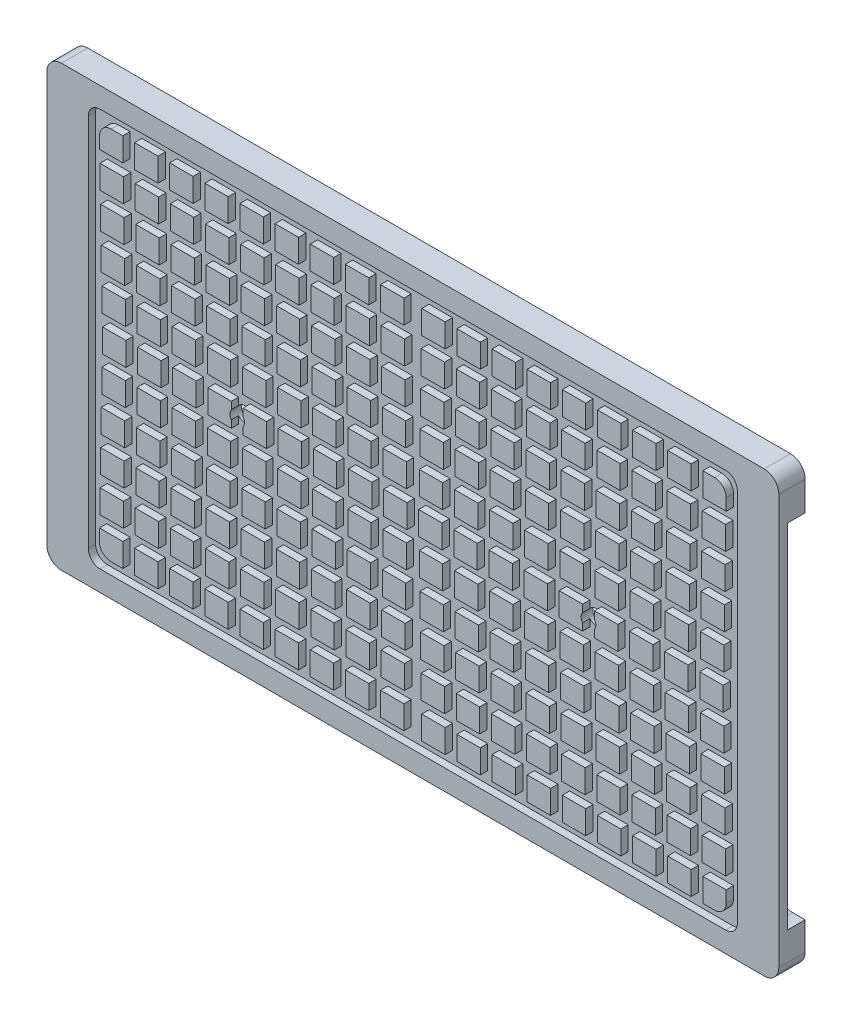
from build123d import *
from build123d.topology import SkipClean

# Parameters (mm, degrees)
EXTRUDE_1_DEPTH     = 9
EXTRUDE_2_DEPTH     = 0.6
CUT_EXTRUDE_1_DEPTH = 6
SKETCH_5_R          = 2.25
CUT_EXTRUDE_2_DEPTH = 15
SKETCH_7_R          = 2.5
CUT_EXTRUDE_3_DEPTH = 15
SKETCH_8_R          = 2.5
CUT_EXTRUDE_4_DEPTH = 5
CUT_EXTRUDE_START   = -2.5
SKETCH_9_W          = 8
SKETCH_9_H          = 8
CUT_EXTRUDE_5_DEPTH = 2.5
SKETCH_10_R         = 1.25
CUT_EXTRUDE_6_DEPTH = 6.5
CUT_EXTRUDE_7_DEPTH = 1


with BuildPart() as part:
    # 草图2 → 凸台-拉伸1 (new body)
    with BuildSketch(Plane.XY):
        with BuildLine():
            Line((-120, 75), (120, 75))
            ThreePointArc((120, 75), (123.535533906, 73.535533906), (125, 70))
            Line((125, 70), (125, -70))
            ThreePointArc((125, -70), (123.535533906, -73.535533906), (120, -75))
            Line((120, -75), (-120, -75))
            ThreePointArc((-120, -75), (-123.535533906, -73.535533906), (-125, -70))
            Line((-125, -70), (-125, 70))
            ThreePointArc((-125, 70), (-123.535533906, 73.535533906), (-120, 75))
        make_face()
    extrude(amount=EXTRUDE_1_DEPTH)

    # 草图3 → 凸台-拉伸2 (add)
    with BuildSketch(Plane(origin=(0, 0, 0), x_dir=(-1, 0, 0), z_dir=(0, 0, -1))):
        with BuildLine():
            Line((-99.253334042, 67), (99.253334042, 67))
            ThreePointArc((99.253334042, 67), (104.731054073, 64.731054073), (107, 59.253334042))
            Line((107, 59.253334042), (107, -59.253334042))
            ThreePointArc((107, -59.253334042), (104.731054073, -64.731054073), (99.253334042, -67))
            Line((99.253334042, -67), (-99.253334042, -67))
            ThreePointArc((-99.253334042, -67), (-104.731054073, -64.731054073), (-107, -59.253334042))
            Line((-107, -59.253334042), (-107, 59.253334042))
            ThreePointArc((-107, 59.253334042), (-104.731054073, 64.731054073), (-99.253334042, 67))
        make_face()
        with BuildLine():
            Line((-99.253334042, 65), (99.253334042, 65))
            ThreePointArc((99.253334042, 65), (103.31684051, 63.31684051), (105, 59.253334042))
            Line((105, 59.253334042), (105, -59.253334042))
            ThreePointArc((105, -59.253334042), (103.31684051, -63.31684051), (99.253334042, -65))
            Line((99.253334042, -65), (-99.253334042, -65))
            ThreePointArc((-99.253334042, -65), (-103.31684051, -63.31684051), (-105, -59.253334042))
            Line((-105, -59.253334042), (-105, 59.253334042))
            ThreePointArc((-105, 59.253334042), (-103.31684051, 63.31684051), (-99.253334042, 65))
        make_face(mode=Mode.SUBTRACT)
    extrude(amount=EXTRUDE_2_DEPTH)

    # 草图4 → 切除-拉伸1 (cut)
    with BuildSketch(Plane(origin=(0, 0, 0), x_dir=(-1, 0, 0), z_dir=(0, 0, -1))):
        with BuildLine():
            Line((125, -60.380854599), (120.746665958, -60.380854599))
            ThreePointArc((120.746665958, -60.380854599), (116.68315949, -58.697695109), (115, -54.634188641))
            Line((115, -54.634188641), (115, 54.253334042))
            ThreePointArc((115, 54.253334042), (116.68315949, 58.31684051), (120.746665958, 60))
            Line((120.746665958, 60), (125, 60))
            Line((125, 60), (125, -60.380854599))
        make_face()
        with BuildLine():
            Line((-115, -54.634188641), (-115, 54.253334042))
            ThreePointArc((-115, 54.253334042), (-116.68315949, 58.31684051), (-120.746665958, 60))
            Line((-120.746665958, 60), (-125, 60))
            Line((-125, 60), (-125, -60.380854599))
            Line((-125, -60.380854599), (-120.746665958, -60.380854599))
            ThreePointArc((-120.746665958, -60.380854599), (-116.68315949, -58.697695109), (-115, -54.634188641))
        make_face()
    extrude(amount=-CUT_EXTRUDE_1_DEPTH, mode=Mode.SUBTRACT)

    # 草图5 → 切除-拉伸2 (cut)
    with BuildSketch(Plane.XZ.offset(75)):
        with Locations((-15, 3.5)):
            Circle(SKETCH_5_R)
        with Locations((15, 3.5)):
            Circle(SKETCH_5_R)
    extrude(amount=-CUT_EXTRUDE_2_DEPTH, mode=Mode.SUBTRACT)

    # 草图7 → 切除-拉伸3 (cut)
    with BuildSketch(Plane(origin=(0, 0, 0), x_dir=(-1, 0, 0), z_dir=(0, 0, -1))):
        with Locations((60, 0)):
            Circle(SKETCH_7_R)
        with Locations((-60, 0)):
            Circle(SKETCH_7_R)
    extrude(amount=-CUT_EXTRUDE_3_DEPTH, mode=Mode.SUBTRACT)

    # 草图8 → 切除-拉伸4 (cut)
    # profile 1 of 2: a face of its own
    with BuildSketch(Plane(origin=(0, 0, 0), x_dir=(-1, 0, 0), z_dir=(0, 0, -1))):
        with BuildLine():
            Line((95.911033681, 60), (7.088966319, 60))
            ThreePointArc((7.088966319, 60), (4.197630507, 58.802369493), (3, 55.911033681))
            Line((3, 55.911033681), (3, -55.911033681))
            ThreePointArc((3, -55.911033681), (4.197630507, -58.802369493), (7.088966319, -60))
            Line((7.088966319, -60), (95, -60))
            ThreePointArc((95, -60), (98.535533906, -58.535533906), (100, -55))
            Line((100, -55), (100, 55.911033681))
            ThreePointArc((100, 55.911033681), (98.802369493, 58.802369493), (95.911033681, 60))
        make_face()
        with Locations((60, 0)):
            Circle(SKETCH_8_R, mode=Mode.SUBTRACT)
    # profile 2 of 2: a face of its own
    with BuildSketch(Plane(origin=(0, 0, 0), x_dir=(-1, 0, 0), z_dir=(0, 0, -1))):
        with BuildLine():
            Line((-7.088966319, 60), (-95, 60))
            ThreePointArc((-95, 60), (-98.535533906, 58.535533906), (-100, 55))
            Line((-100, 55), (-100, -55))
            ThreePointArc((-100, -55), (-98.535533906, -58.535533906), (-95, -60))
            Line((-95, -60), (-7.088966319, -60))
            ThreePointArc((-7.088966319, -60), (-4.197630507, -58.802369493), (-3, -55.911033681))
            Line((-3, -55.911033681), (-3, 55.911033681))
            ThreePointArc((-3, 55.911033681), (-4.197630507, 58.802369493), (-7.088966319, 60))
        make_face()
        with Locations((-60, 0)):
            Circle(SKETCH_8_R, mode=Mode.SUBTRACT)
    extrude(amount=-CUT_EXTRUDE_4_DEPTH, mode=Mode.SUBTRACT)

    # 草图9 → 切除-拉伸5 (cut)
    with SkipClean():  # the faces are left unmerged after this step: merging them gives an invalid solid
        with BuildSketch(Plane.XY.offset(9).offset(CUT_EXTRUDE_START)):
            with BuildLine():
                Line((106.837715509, 67.990861709), (-106.837715509, 67.990861709))
                ThreePointArc((-106.837715509, 67.990861709), (-109.666142634, 66.819288834), (-110.837715509, 63.990861709))
                Line((-110.837715509, 63.990861709), (-110.837715509, -63.990861709))
                ThreePointArc((-110.837715509, -63.990861709), (-109.666142634, -66.819288834), (-106.837715509, -67.990861709))
                Line((-106.837715509, -67.990861709), (106.837715509, -67.990861709))
                ThreePointArc((106.837715509, -67.990861709), (109.666142634, -66.819288834), (110.837715509, -63.990861709))
                Line((110.837715509, -63.990861709), (110.837715509, 63.990861709))
                ThreePointArc((110.837715509, 63.990861709), (109.666142634, 66.819288834), (106.837715509, 67.990861709))
            make_face()
            with BuildLine():
                Line((-107.047144386, -59.990861709), (-107.047144386, -55.990861709))
                Line((-107.047144386, -55.990861709), (-99.047144386, -55.990861709))
                Line((-99.047144386, -55.990861709), (-99.047144386, -63.990861709))
                Line((-99.047144386, -63.990861709), (-103.047144386, -63.990861709))
                ThreePointArc((-103.047144386, -63.990861709), (-105.875571511, -62.819288834), (-107.047144386, -59.990861709))
            make_face(mode=Mode.SUBTRACT)
            with Locations((-91.047144386, -59.990861709)):
                Rectangle(SKETCH_9_W, SKETCH_9_H, mode=Mode.SUBTRACT)
            with Locations((-79.047144386, -59.990861709)):
                Rectangle(SKETCH_9_W, SKETCH_9_H, mode=Mode.SUBTRACT)
            with Locations((-67.047144386, -59.990861709)):
                Rectangle(SKETCH_9_W, SKETCH_9_H, mode=Mode.SUBTRACT)
            with Locations((-102.837715509, -47.992689368)):
                Rectangle(SKETCH_9_W, SKETCH_9_H, mode=Mode.SUBTRACT)
            with Locations((-90.837715509, -47.992689368)):
                Rectangle(SKETCH_9_W, SKETCH_9_H, mode=Mode.SUBTRACT)
            with Locations((-102.628286632, -35.994517026)):
                Rectangle(SKETCH_9_W, SKETCH_9_H, mode=Mode.SUBTRACT)
            with Locations((-90.628286632, -35.994517026)):
                Rectangle(SKETCH_9_W, SKETCH_9_H, mode=Mode.SUBTRACT)
            with Locations((-78.837715509, -47.992689368)):
                Rectangle(SKETCH_9_W, SKETCH_9_H, mode=Mode.SUBTRACT)
            with Locations((-66.837715509, -47.992689368)):
                Rectangle(SKETCH_9_W, SKETCH_9_H, mode=Mode.SUBTRACT)
            with Locations((-78.628286632, -35.994517026)):
                Rectangle(SKETCH_9_W, SKETCH_9_H, mode=Mode.SUBTRACT)
            with Locations((-66.628286632, -35.994517026)):
                Rectangle(SKETCH_9_W, SKETCH_9_H, mode=Mode.SUBTRACT)
            with Locations((-55.047144386, -59.990861709)):
                Rectangle(SKETCH_9_W, SKETCH_9_H, mode=Mode.SUBTRACT)
            with Locations((-43.047144386, -59.990861709)):
                Rectangle(SKETCH_9_W, SKETCH_9_H, mode=Mode.SUBTRACT)
            with Locations((-31.047144386, -59.990861709)):
                Rectangle(SKETCH_9_W, SKETCH_9_H, mode=Mode.SUBTRACT)
            with Locations((-19.047144386, -59.990861709)):
                Rectangle(SKETCH_9_W, SKETCH_9_H, mode=Mode.SUBTRACT)
            with Locations((-7.047144386, -59.990861709)):
                Rectangle(SKETCH_9_W, SKETCH_9_H, mode=Mode.SUBTRACT)
            with Locations((-54.837715509, -47.992689368)):
                Rectangle(SKETCH_9_W, SKETCH_9_H, mode=Mode.SUBTRACT)
            with Locations((-42.837715509, -47.992689368)):
                Rectangle(SKETCH_9_W, SKETCH_9_H, mode=Mode.SUBTRACT)
            with Locations((-30.837715509, -47.992689368)):
                Rectangle(SKETCH_9_W, SKETCH_9_H, mode=Mode.SUBTRACT)
            with Locations((-54.628286632, -35.994517026)):
                Rectangle(SKETCH_9_W, SKETCH_9_H, mode=Mode.SUBTRACT)
            with Locations((-42.628286632, -35.994517026)):
                Rectangle(SKETCH_9_W, SKETCH_9_H, mode=Mode.SUBTRACT)
            with Locations((-30.628286632, -35.994517026)):
                Rectangle(SKETCH_9_W, SKETCH_9_H, mode=Mode.SUBTRACT)
            with Locations((-18.837715509, -47.992689368)):
                Rectangle(SKETCH_9_W, SKETCH_9_H, mode=Mode.SUBTRACT)
            with Locations((-6.837715509, -47.992689368)):
                Rectangle(SKETCH_9_W, SKETCH_9_H, mode=Mode.SUBTRACT)
            with Locations((-18.628286632, -35.994517026)):
                Rectangle(SKETCH_9_W, SKETCH_9_H, mode=Mode.SUBTRACT)
            with Locations((-6.628286632, -35.994517026)):
                Rectangle(SKETCH_9_W, SKETCH_9_H, mode=Mode.SUBTRACT)
            with Locations((-102.418857754, -23.996344684)):
                Rectangle(SKETCH_9_W, SKETCH_9_H, mode=Mode.SUBTRACT)
            with Locations((-90.418857754, -23.996344684)):
                Rectangle(SKETCH_9_W, SKETCH_9_H, mode=Mode.SUBTRACT)
            with Locations((-78.418857754, -23.996344684)):
                Rectangle(SKETCH_9_W, SKETCH_9_H, mode=Mode.SUBTRACT)
            with Locations((-66.418857754, -23.996344684)):
                Rectangle(SKETCH_9_W, SKETCH_9_H, mode=Mode.SUBTRACT)
            with Locations((-102.209428877, -11.998172342)):
                Rectangle(SKETCH_9_W, SKETCH_9_H, mode=Mode.SUBTRACT)
            with Locations((-90.209428877, -11.998172342)):
                Rectangle(SKETCH_9_W, SKETCH_9_H, mode=Mode.SUBTRACT)
            with Locations((-102, 0)):
                Rectangle(SKETCH_9_W, SKETCH_9_H, mode=Mode.SUBTRACT)
            with Locations((-90, 0)):
                Rectangle(SKETCH_9_W, SKETCH_9_H, mode=Mode.SUBTRACT)
            with Locations((-78.209428877, -11.998172342)):
                Rectangle(SKETCH_9_W, SKETCH_9_H, mode=Mode.SUBTRACT)
            with Locations((-66.209428877, -11.998172342)):
                Rectangle(SKETCH_9_W, SKETCH_9_H, mode=Mode.SUBTRACT)
            with Locations((-78, 0)):
                Rectangle(SKETCH_9_W, SKETCH_9_H, mode=Mode.SUBTRACT)
            with BuildLine():
                Line((-62, -1.5), (-62, -4))
                Line((-62, -4), (-70, -4))
                Line((-70, -4), (-70, 4))
                Line((-70, 4), (-62, 4))
                Line((-62, 4), (-62, 1.5))
                ThreePointArc((-62, 1.5), (-62.5, 0), (-62, -1.5))
            make_face(mode=Mode.SUBTRACT)
            with Locations((-54.418857754, -23.996344684)):
                Rectangle(SKETCH_9_W, SKETCH_9_H, mode=Mode.SUBTRACT)
            with Locations((-42.418857754, -23.996344684)):
                Rectangle(SKETCH_9_W, SKETCH_9_H, mode=Mode.SUBTRACT)
            with Locations((-30.418857754, -23.996344684)):
                Rectangle(SKETCH_9_W, SKETCH_9_H, mode=Mode.SUBTRACT)
            with Locations((-18.418857754, -23.996344684)):
                Rectangle(SKETCH_9_W, SKETCH_9_H, mode=Mode.SUBTRACT)
            with Locations((-6.418857754, -23.996344684)):
                Rectangle(SKETCH_9_W, SKETCH_9_H, mode=Mode.SUBTRACT)
            with Locations((-54.209428877, -11.998172342)):
                Rectangle(SKETCH_9_W, SKETCH_9_H, mode=Mode.SUBTRACT)
            with Locations((-42.209428877, -11.998172342)):
                Rectangle(SKETCH_9_W, SKETCH_9_H, mode=Mode.SUBTRACT)
            with Locations((-30.209428877, -11.998172342)):
                Rectangle(SKETCH_9_W, SKETCH_9_H, mode=Mode.SUBTRACT)
            with BuildLine():
                Line((-50, 4), (-50, -4))
                Line((-50, -4), (-58, -4))
                Line((-58, -4), (-58, -1.5))
                ThreePointArc((-58, -1.5), (-57.5, 0), (-58, 1.5))
                Line((-58, 1.5), (-58, 4))
                Line((-58, 4), (-50, 4))
            make_face(mode=Mode.SUBTRACT)
            with Locations((-42, 0)):
                Rectangle(SKETCH_9_W, SKETCH_9_H, mode=Mode.SUBTRACT)
            with Locations((-30, 0)):
                Rectangle(SKETCH_9_W, SKETCH_9_H, mode=Mode.SUBTRACT)
            with Locations((-18.209428877, -11.998172342)):
                Rectangle(SKETCH_9_W, SKETCH_9_H, mode=Mode.SUBTRACT)
            with Locations((-6.209428877, -11.998172342)):
                Rectangle(SKETCH_9_W, SKETCH_9_H, mode=Mode.SUBTRACT)
            with Locations((-18, 0)):
                Rectangle(SKETCH_9_W, SKETCH_9_H, mode=Mode.SUBTRACT)
            with Locations((7.047144386, -59.990861709)):
                Rectangle(SKETCH_9_W, SKETCH_9_H, mode=Mode.SUBTRACT)
            with Locations((19.047144386, -59.990861709)):
                Rectangle(SKETCH_9_W, SKETCH_9_H, mode=Mode.SUBTRACT)
            with Locations((31.047144386, -59.990861709)):
                Rectangle(SKETCH_9_W, SKETCH_9_H, mode=Mode.SUBTRACT)
            with Locations((43.047144386, -59.990861709)):
                Rectangle(SKETCH_9_W, SKETCH_9_H, mode=Mode.SUBTRACT)
            with Locations((55.047144386, -59.990861709)):
                Rectangle(SKETCH_9_W, SKETCH_9_H, mode=Mode.SUBTRACT)
            with Locations((6.837715509, -47.992689368)):
                Rectangle(SKETCH_9_W, SKETCH_9_H, mode=Mode.SUBTRACT)
            with Locations((18.837715509, -47.992689368)):
                Rectangle(SKETCH_9_W, SKETCH_9_H, mode=Mode.SUBTRACT)
            with Locations((6.628286632, -35.994517026)):
                Rectangle(SKETCH_9_W, SKETCH_9_H, mode=Mode.SUBTRACT)
            with Locations((18.628286632, -35.994517026)):
                Rectangle(SKETCH_9_W, SKETCH_9_H, mode=Mode.SUBTRACT)
            with Locations((30.837715509, -47.992689368)):
                Rectangle(SKETCH_9_W, SKETCH_9_H, mode=Mode.SUBTRACT)
            with Locations((42.837715509, -47.992689368)):
                Rectangle(SKETCH_9_W, SKETCH_9_H, mode=Mode.SUBTRACT)
            with Locations((54.837715509, -47.992689368)):
                Rectangle(SKETCH_9_W, SKETCH_9_H, mode=Mode.SUBTRACT)
            with Locations((30.628286632, -35.994517026)):
                Rectangle(SKETCH_9_W, SKETCH_9_H, mode=Mode.SUBTRACT)
            with Locations((42.628286632, -35.994517026)):
                Rectangle(SKETCH_9_W, SKETCH_9_H, mode=Mode.SUBTRACT)
            with Locations((54.628286632, -35.994517026)):
                Rectangle(SKETCH_9_W, SKETCH_9_H, mode=Mode.SUBTRACT)
            with Locations((67.047144386, -59.990861709)):
                Rectangle(SKETCH_9_W, SKETCH_9_H, mode=Mode.SUBTRACT)
            with Locations((79.047144386, -59.990861709)):
                Rectangle(SKETCH_9_W, SKETCH_9_H, mode=Mode.SUBTRACT)
            with Locations((91.047144386, -59.990861709)):
                Rectangle(SKETCH_9_W, SKETCH_9_H, mode=Mode.SUBTRACT)
            with BuildLine():
                Line((99.047144386, -63.990861709), (99.047144386, -55.990861709))
                Line((99.047144386, -55.990861709), (107.047144386, -55.990861709))
                Line((107.047144386, -55.990861709), (107.047144386, -59.990861709))
                ThreePointArc((107.047144386, -59.990861709), (105.875571511, -62.819288834), (103.047144386, -63.990861709))
                Line((103.047144386, -63.990861709), (99.047144386, -63.990861709))
            make_face(mode=Mode.SUBTRACT)
            with Locations((66.837715509, -47.992689368)):
                Rectangle(SKETCH_9_W, SKETCH_9_H, mode=Mode.SUBTRACT)
            with Locations((78.837715509, -47.992689368)):
                Rectangle(SKETCH_9_W, SKETCH_9_H, mode=Mode.SUBTRACT)
            with Locations((66.628286632, -35.994517026)):
                Rectangle(SKETCH_9_W, SKETCH_9_H, mode=Mode.SUBTRACT)
            with Locations((78.628286632, -35.994517026)):
                Rectangle(SKETCH_9_W, SKETCH_9_H, mode=Mode.SUBTRACT)
            with Locations((90.837715509, -47.992689368)):
                Rectangle(SKETCH_9_W, SKETCH_9_H, mode=Mode.SUBTRACT)
            with Locations((102.837715509, -47.992689368)):
                Rectangle(SKETCH_9_W, SKETCH_9_H, mode=Mode.SUBTRACT)
            with Locations((90.628286632, -35.994517026)):
                Rectangle(SKETCH_9_W, SKETCH_9_H, mode=Mode.SUBTRACT)
            with Locations((102.628286632, -35.994517026)):
                Rectangle(SKETCH_9_W, SKETCH_9_H, mode=Mode.SUBTRACT)
            with Locations((6.418857754, -23.996344684)):
                Rectangle(SKETCH_9_W, SKETCH_9_H, mode=Mode.SUBTRACT)
            with Locations((18.418857754, -23.996344684)):
                Rectangle(SKETCH_9_W, SKETCH_9_H, mode=Mode.SUBTRACT)
            with Locations((30.418857754, -23.996344684)):
                Rectangle(SKETCH_9_W, SKETCH_9_H, mode=Mode.SUBTRACT)
            with Locations((42.418857754, -23.996344684)):
                Rectangle(SKETCH_9_W, SKETCH_9_H, mode=Mode.SUBTRACT)
            with Locations((54.418857754, -23.996344684)):
                Rectangle(SKETCH_9_W, SKETCH_9_H, mode=Mode.SUBTRACT)
            with Locations((6.209428877, -11.998172342)):
                Rectangle(SKETCH_9_W, SKETCH_9_H, mode=Mode.SUBTRACT)
            with Locations((18.209428877, -11.998172342)):
                Rectangle(SKETCH_9_W, SKETCH_9_H, mode=Mode.SUBTRACT)
            with Locations((18, 0)):
                Rectangle(SKETCH_9_W, SKETCH_9_H, mode=Mode.SUBTRACT)
            with Locations((30.209428877, -11.998172342)):
                Rectangle(SKETCH_9_W, SKETCH_9_H, mode=Mode.SUBTRACT)
            with Locations((42.209428877, -11.998172342)):
                Rectangle(SKETCH_9_W, SKETCH_9_H, mode=Mode.SUBTRACT)
            with Locations((54.209428877, -11.998172342)):
                Rectangle(SKETCH_9_W, SKETCH_9_H, mode=Mode.SUBTRACT)
            with Locations((30, 0)):
                Rectangle(SKETCH_9_W, SKETCH_9_H, mode=Mode.SUBTRACT)
            with Locations((42, 0)):
                Rectangle(SKETCH_9_W, SKETCH_9_H, mode=Mode.SUBTRACT)
            with BuildLine():
                Line((58, -1.5), (58, -4))
                Line((58, -4), (50, -4))
                Line((50, -4), (50, 4))
                Line((50, 4), (58, 4))
                Line((58, 4), (58, 1.5))
                ThreePointArc((58, 1.5), (57.5, 0), (58, -1.5))
            make_face(mode=Mode.SUBTRACT)
            with Locations((66.418857754, -23.996344684)):
                Rectangle(SKETCH_9_W, SKETCH_9_H, mode=Mode.SUBTRACT)
            with Locations((78.418857754, -23.996344684)):
                Rectangle(SKETCH_9_W, SKETCH_9_H, mode=Mode.SUBTRACT)
            with Locations((90.418857754, -23.996344684)):
                Rectangle(SKETCH_9_W, SKETCH_9_H, mode=Mode.SUBTRACT)
            with Locations((102.418857754, -23.996344684)):
                Rectangle(SKETCH_9_W, SKETCH_9_H, mode=Mode.SUBTRACT)
            with Locations((66.209428877, -11.998172342)):
                Rectangle(SKETCH_9_W, SKETCH_9_H, mode=Mode.SUBTRACT)
            with Locations((78.209428877, -11.998172342)):
                Rectangle(SKETCH_9_W, SKETCH_9_H, mode=Mode.SUBTRACT)
            with BuildLine():
                Line((70, 4), (70, -4))
                Line((70, -4), (62, -4))
                Line((62, -4), (62, -1.5))
                ThreePointArc((62, -1.5), (62.5, 0), (62, 1.5))
                Line((62, 1.5), (62, 4))
                Line((62, 4), (70, 4))
            make_face(mode=Mode.SUBTRACT)
            with Locations((78, 0)):
                Rectangle(SKETCH_9_W, SKETCH_9_H, mode=Mode.SUBTRACT)
            with Locations((90.209428877, -11.998172342)):
                Rectangle(SKETCH_9_W, SKETCH_9_H, mode=Mode.SUBTRACT)
            with Locations((102.209428877, -11.998172342)):
                Rectangle(SKETCH_9_W, SKETCH_9_H, mode=Mode.SUBTRACT)
            with Locations((90, 0)):
                Rectangle(SKETCH_9_W, SKETCH_9_H, mode=Mode.SUBTRACT)
            with Locations((102, 0)):
                Rectangle(SKETCH_9_W, SKETCH_9_H, mode=Mode.SUBTRACT)
            with Locations((-102.209428877, 11.998172342)):
                Rectangle(SKETCH_9_W, SKETCH_9_H, mode=Mode.SUBTRACT)
            with Locations((-90.209428877, 11.998172342)):
                Rectangle(SKETCH_9_W, SKETCH_9_H, mode=Mode.SUBTRACT)
            with Locations((-78.209428877, 11.998172342)):
                Rectangle(SKETCH_9_W, SKETCH_9_H, mode=Mode.SUBTRACT)
            with Locations((-66.209428877, 11.998172342)):
                Rectangle(SKETCH_9_W, SKETCH_9_H, mode=Mode.SUBTRACT)
            with Locations((-102.418857754, 23.996344684)):
                Rectangle(SKETCH_9_W, SKETCH_9_H, mode=Mode.SUBTRACT)
            with Locations((-90.418857754, 23.996344684)):
                Rectangle(SKETCH_9_W, SKETCH_9_H, mode=Mode.SUBTRACT)
            with Locations((-78.418857754, 23.996344684)):
                Rectangle(SKETCH_9_W, SKETCH_9_H, mode=Mode.SUBTRACT)
            with Locations((-66.418857754, 23.996344684)):
                Rectangle(SKETCH_9_W, SKETCH_9_H, mode=Mode.SUBTRACT)
            with Locations((-54.209428877, 11.998172342)):
                Rectangle(SKETCH_9_W, SKETCH_9_H, mode=Mode.SUBTRACT)
            with Locations((-42.209428877, 11.998172342)):
                Rectangle(SKETCH_9_W, SKETCH_9_H, mode=Mode.SUBTRACT)
            with Locations((-30.209428877, 11.998172342)):
                Rectangle(SKETCH_9_W, SKETCH_9_H, mode=Mode.SUBTRACT)
            with Locations((-6, 0)):
                Rectangle(SKETCH_9_W, SKETCH_9_H, mode=Mode.SUBTRACT)
            with Locations((-18.209428877, 11.998172342)):
                Rectangle(SKETCH_9_W, SKETCH_9_H, mode=Mode.SUBTRACT)
            with Locations((-6.209428877, 11.998172342)):
                Rectangle(SKETCH_9_W, SKETCH_9_H, mode=Mode.SUBTRACT)
            with Locations((-54.418857754, 23.996344684)):
                Rectangle(SKETCH_9_W, SKETCH_9_H, mode=Mode.SUBTRACT)
            with Locations((-42.418857754, 23.996344684)):
                Rectangle(SKETCH_9_W, SKETCH_9_H, mode=Mode.SUBTRACT)
            with Locations((-30.418857754, 23.996344684)):
                Rectangle(SKETCH_9_W, SKETCH_9_H, mode=Mode.SUBTRACT)
            with Locations((-18.418857754, 23.996344684)):
                Rectangle(SKETCH_9_W, SKETCH_9_H, mode=Mode.SUBTRACT)
            with Locations((-6.418857754, 23.996344684)):
                Rectangle(SKETCH_9_W, SKETCH_9_H, mode=Mode.SUBTRACT)
            with Locations((-102.628286632, 35.994517026)):
                Rectangle(SKETCH_9_W, SKETCH_9_H, mode=Mode.SUBTRACT)
            with Locations((-90.628286632, 35.994517026)):
                Rectangle(SKETCH_9_W, SKETCH_9_H, mode=Mode.SUBTRACT)
            with Locations((-102.837715509, 47.992689368)):
                Rectangle(SKETCH_9_W, SKETCH_9_H, mode=Mode.SUBTRACT)
            with Locations((-90.837715509, 47.992689368)):
                Rectangle(SKETCH_9_W, SKETCH_9_H, mode=Mode.SUBTRACT)
            with Locations((-78.628286632, 35.994517026)):
                Rectangle(SKETCH_9_W, SKETCH_9_H, mode=Mode.SUBTRACT)
            with Locations((-66.628286632, 35.994517026)):
                Rectangle(SKETCH_9_W, SKETCH_9_H, mode=Mode.SUBTRACT)
            with Locations((-78.837715509, 47.992689368)):
                Rectangle(SKETCH_9_W, SKETCH_9_H, mode=Mode.SUBTRACT)
            with Locations((-66.837715509, 47.992689368)):
                Rectangle(SKETCH_9_W, SKETCH_9_H, mode=Mode.SUBTRACT)
            with BuildLine():
                Line((-99.047144386, 63.990861709), (-99.047144386, 55.990861709))
                Line((-99.047144386, 55.990861709), (-107.047144386, 55.990861709))
                Line((-107.047144386, 55.990861709), (-107.047144386, 59.990861709))
                ThreePointArc((-107.047144386, 59.990861709), (-105.875571511, 62.819288834), (-103.047144386, 63.990861709))
                Line((-103.047144386, 63.990861709), (-99.047144386, 63.990861709))
            make_face(mode=Mode.SUBTRACT)
            with Locations((-91.047144386, 59.990861709)):
                Rectangle(SKETCH_9_W, SKETCH_9_H, mode=Mode.SUBTRACT)
            with Locations((-79.047144386, 59.990861709)):
                Rectangle(SKETCH_9_W, SKETCH_9_H, mode=Mode.SUBTRACT)
            with Locations((-67.047144386, 59.990861709)):
                Rectangle(SKETCH_9_W, SKETCH_9_H, mode=Mode.SUBTRACT)
            with Locations((-54.628286632, 35.994517026)):
                Rectangle(SKETCH_9_W, SKETCH_9_H, mode=Mode.SUBTRACT)
            with Locations((-42.628286632, 35.994517026)):
                Rectangle(SKETCH_9_W, SKETCH_9_H, mode=Mode.SUBTRACT)
            with Locations((-30.628286632, 35.994517026)):
                Rectangle(SKETCH_9_W, SKETCH_9_H, mode=Mode.SUBTRACT)
            with Locations((-54.837715509, 47.992689368)):
                Rectangle(SKETCH_9_W, SKETCH_9_H, mode=Mode.SUBTRACT)
            with Locations((-42.837715509, 47.992689368)):
                Rectangle(SKETCH_9_W, SKETCH_9_H, mode=Mode.SUBTRACT)
            with Locations((-30.837715509, 47.992689368)):
                Rectangle(SKETCH_9_W, SKETCH_9_H, mode=Mode.SUBTRACT)
            with Locations((-18.628286632, 35.994517026)):
                Rectangle(SKETCH_9_W, SKETCH_9_H, mode=Mode.SUBTRACT)
            with Locations((-6.628286632, 35.994517026)):
                Rectangle(SKETCH_9_W, SKETCH_9_H, mode=Mode.SUBTRACT)
            with Locations((-18.837715509, 47.992689368)):
                Rectangle(SKETCH_9_W, SKETCH_9_H, mode=Mode.SUBTRACT)
            with Locations((-6.837715509, 47.992689368)):
                Rectangle(SKETCH_9_W, SKETCH_9_H, mode=Mode.SUBTRACT)
            with Locations((-55.047144386, 59.990861709)):
                Rectangle(SKETCH_9_W, SKETCH_9_H, mode=Mode.SUBTRACT)
            with Locations((-43.047144386, 59.990861709)):
                Rectangle(SKETCH_9_W, SKETCH_9_H, mode=Mode.SUBTRACT)
            with Locations((-31.047144386, 59.990861709)):
                Rectangle(SKETCH_9_W, SKETCH_9_H, mode=Mode.SUBTRACT)
            with Locations((-19.047144386, 59.990861709)):
                Rectangle(SKETCH_9_W, SKETCH_9_H, mode=Mode.SUBTRACT)
            with Locations((-7.047144386, 59.990861709)):
                Rectangle(SKETCH_9_W, SKETCH_9_H, mode=Mode.SUBTRACT)
            with Locations((6, 0)):
                Rectangle(SKETCH_9_W, SKETCH_9_H, mode=Mode.SUBTRACT)
            with Locations((6.209428877, 11.998172342)):
                Rectangle(SKETCH_9_W, SKETCH_9_H, mode=Mode.SUBTRACT)
            with Locations((18.209428877, 11.998172342)):
                Rectangle(SKETCH_9_W, SKETCH_9_H, mode=Mode.SUBTRACT)
            with Locations((30.209428877, 11.998172342)):
                Rectangle(SKETCH_9_W, SKETCH_9_H, mode=Mode.SUBTRACT)
            with Locations((42.209428877, 11.998172342)):
                Rectangle(SKETCH_9_W, SKETCH_9_H, mode=Mode.SUBTRACT)
            with Locations((54.209428877, 11.998172342)):
                Rectangle(SKETCH_9_W, SKETCH_9_H, mode=Mode.SUBTRACT)
            with Locations((6.418857754, 23.996344684)):
                Rectangle(SKETCH_9_W, SKETCH_9_H, mode=Mode.SUBTRACT)
            with Locations((18.418857754, 23.996344684)):
                Rectangle(SKETCH_9_W, SKETCH_9_H, mode=Mode.SUBTRACT)
            with Locations((30.418857754, 23.996344684)):
                Rectangle(SKETCH_9_W, SKETCH_9_H, mode=Mode.SUBTRACT)
            with Locations((42.418857754, 23.996344684)):
                Rectangle(SKETCH_9_W, SKETCH_9_H, mode=Mode.SUBTRACT)
            with Locations((54.418857754, 23.996344684)):
                Rectangle(SKETCH_9_W, SKETCH_9_H, mode=Mode.SUBTRACT)
            with Locations((66.209428877, 11.998172342)):
                Rectangle(SKETCH_9_W, SKETCH_9_H, mode=Mode.SUBTRACT)
            with Locations((78.209428877, 11.998172342)):
                Rectangle(SKETCH_9_W, SKETCH_9_H, mode=Mode.SUBTRACT)
            with Locations((90.209428877, 11.998172342)):
                Rectangle(SKETCH_9_W, SKETCH_9_H, mode=Mode.SUBTRACT)
            with Locations((102.209428877, 11.998172342)):
                Rectangle(SKETCH_9_W, SKETCH_9_H, mode=Mode.SUBTRACT)
            with Locations((66.418857754, 23.996344684)):
                Rectangle(SKETCH_9_W, SKETCH_9_H, mode=Mode.SUBTRACT)
            with Locations((78.418857754, 23.996344684)):
                Rectangle(SKETCH_9_W, SKETCH_9_H, mode=Mode.SUBTRACT)
            with Locations((90.418857754, 23.996344684)):
                Rectangle(SKETCH_9_W, SKETCH_9_H, mode=Mode.SUBTRACT)
            with Locations((102.418857754, 23.996344684)):
                Rectangle(SKETCH_9_W, SKETCH_9_H, mode=Mode.SUBTRACT)
            with Locations((6.628286632, 35.994517026)):
                Rectangle(SKETCH_9_W, SKETCH_9_H, mode=Mode.SUBTRACT)
            with Locations((18.628286632, 35.994517026)):
                Rectangle(SKETCH_9_W, SKETCH_9_H, mode=Mode.SUBTRACT)
            with Locations((6.837715509, 47.992689368)):
                Rectangle(SKETCH_9_W, SKETCH_9_H, mode=Mode.SUBTRACT)
            with Locations((18.837715509, 47.992689368)):
                Rectangle(SKETCH_9_W, SKETCH_9_H, mode=Mode.SUBTRACT)
            with Locations((30.628286632, 35.994517026)):
                Rectangle(SKETCH_9_W, SKETCH_9_H, mode=Mode.SUBTRACT)
            with Locations((42.628286632, 35.994517026)):
                Rectangle(SKETCH_9_W, SKETCH_9_H, mode=Mode.SUBTRACT)
            with Locations((54.628286632, 35.994517026)):
                Rectangle(SKETCH_9_W, SKETCH_9_H, mode=Mode.SUBTRACT)
            with Locations((30.837715509, 47.992689368)):
                Rectangle(SKETCH_9_W, SKETCH_9_H, mode=Mode.SUBTRACT)
            with Locations((42.837715509, 47.992689368)):
                Rectangle(SKETCH_9_W, SKETCH_9_H, mode=Mode.SUBTRACT)
            with Locations((54.837715509, 47.992689368)):
                Rectangle(SKETCH_9_W, SKETCH_9_H, mode=Mode.SUBTRACT)
            with Locations((7.047144386, 59.990861709)):
                Rectangle(SKETCH_9_W, SKETCH_9_H, mode=Mode.SUBTRACT)
            with Locations((19.047144386, 59.990861709)):
                Rectangle(SKETCH_9_W, SKETCH_9_H, mode=Mode.SUBTRACT)
            with Locations((31.047144386, 59.990861709)):
                Rectangle(SKETCH_9_W, SKETCH_9_H, mode=Mode.SUBTRACT)
            with Locations((43.047144386, 59.990861709)):
                Rectangle(SKETCH_9_W, SKETCH_9_H, mode=Mode.SUBTRACT)
            with Locations((55.047144386, 59.990861709)):
                Rectangle(SKETCH_9_W, SKETCH_9_H, mode=Mode.SUBTRACT)
            with Locations((66.628286632, 35.994517026)):
                Rectangle(SKETCH_9_W, SKETCH_9_H, mode=Mode.SUBTRACT)
            with Locations((78.628286632, 35.994517026)):
                Rectangle(SKETCH_9_W, SKETCH_9_H, mode=Mode.SUBTRACT)
            with Locations((66.837715509, 47.992689368)):
                Rectangle(SKETCH_9_W, SKETCH_9_H, mode=Mode.SUBTRACT)
            with Locations((78.837715509, 47.992689368)):
                Rectangle(SKETCH_9_W, SKETCH_9_H, mode=Mode.SUBTRACT)
            with Locations((90.628286632, 35.994517026)):
                Rectangle(SKETCH_9_W, SKETCH_9_H, mode=Mode.SUBTRACT)
            with Locations((102.628286632, 35.994517026)):
                Rectangle(SKETCH_9_W, SKETCH_9_H, mode=Mode.SUBTRACT)
            with Locations((90.837715509, 47.992689368)):
                Rectangle(SKETCH_9_W, SKETCH_9_H, mode=Mode.SUBTRACT)
            with Locations((102.837715509, 47.992689368)):
                Rectangle(SKETCH_9_W, SKETCH_9_H, mode=Mode.SUBTRACT)
            with Locations((67.047144386, 59.990861709)):
                Rectangle(SKETCH_9_W, SKETCH_9_H, mode=Mode.SUBTRACT)
            with Locations((79.047144386, 59.990861709)):
                Rectangle(SKETCH_9_W, SKETCH_9_H, mode=Mode.SUBTRACT)
            with Locations((91.047144386, 59.990861709)):
                Rectangle(SKETCH_9_W, SKETCH_9_H, mode=Mode.SUBTRACT)
            with BuildLine():
                Line((107.047144386, 59.990861709), (107.047144386, 55.990861709))
                Line((107.047144386, 55.990861709), (99.047144386, 55.990861709))
                Line((99.047144386, 55.990861709), (99.047144386, 63.990861709))
                Line((99.047144386, 63.990861709), (103.047144386, 63.990861709))
                ThreePointArc((103.047144386, 63.990861709), (105.875571511, 62.819288834), (107.047144386, 59.990861709))
            make_face(mode=Mode.SUBTRACT)
        extrude(amount=CUT_EXTRUDE_5_DEPTH, mode=Mode.SUBTRACT)

    # 草图10 → 切除-拉伸6 (cut)
    with SkipClean():  # the faces are left unmerged after this step: merging them gives an invalid solid
        with BuildSketch(Plane(origin=(0, 0, 0), x_dir=(-1, 0, 0), z_dir=(0, 0, -1))):
            with Locations((120, -70)):
                Circle(SKETCH_10_R)
            with Locations((60.164669271, -71)):
                Circle(SKETCH_10_R)
            with Locations((0, -71)):
                Circle(SKETCH_10_R)
            with Locations((-60.164669271, -71)):
                Circle(SKETCH_10_R)
            with Locations((-120, -70)):
                Circle(SKETCH_10_R)
            with Locations((-120, 70)):
                Circle(SKETCH_10_R)
            with Locations((-60.164669271, 71)):
                Circle(SKETCH_10_R)
            with Locations((0, 71)):
                Circle(SKETCH_10_R)
            with Locations((60.164669271, 71)):
                Circle(SKETCH_10_R)
            with Locations((120, 70)):
                Circle(SKETCH_10_R)
        extrude(amount=-CUT_EXTRUDE_6_DEPTH, mode=Mode.SUBTRACT)

    # 草图11 → 切除-拉伸7 (cut)
    with SkipClean():  # the faces are left unmerged after this step: merging them gives an invalid solid
        with BuildSketch(Plane(origin=(0, 0, 0), x_dir=(-1, 0, 0), z_dir=(0, 0, -1))):
            with BuildLine():
                Line((-0.5, 65), (0.5, 65))
                ThreePointArc((0.5, 65), (0.853553391, 64.853553391), (1, 64.5))
                Line((1, 64.5), (1, -64.5))
                ThreePointArc((1, -64.5), (0.853553391, -64.853553391), (0.5, -65))
                Line((0.5, -65), (-0.5, -65))
                ThreePointArc((-0.5, -65), (-0.853553391, -64.853553391), (-1, -64.5))
                Line((-1, -64.5), (-1, 64.5))
                ThreePointArc((-1, 64.5), (-0.853553391, 64.853553391), (-0.5, 65))
            make_face()
        extrude(amount=-CUT_EXTRUDE_7_DEPTH, mode=Mode.SUBTRACT)


solid = part.part
